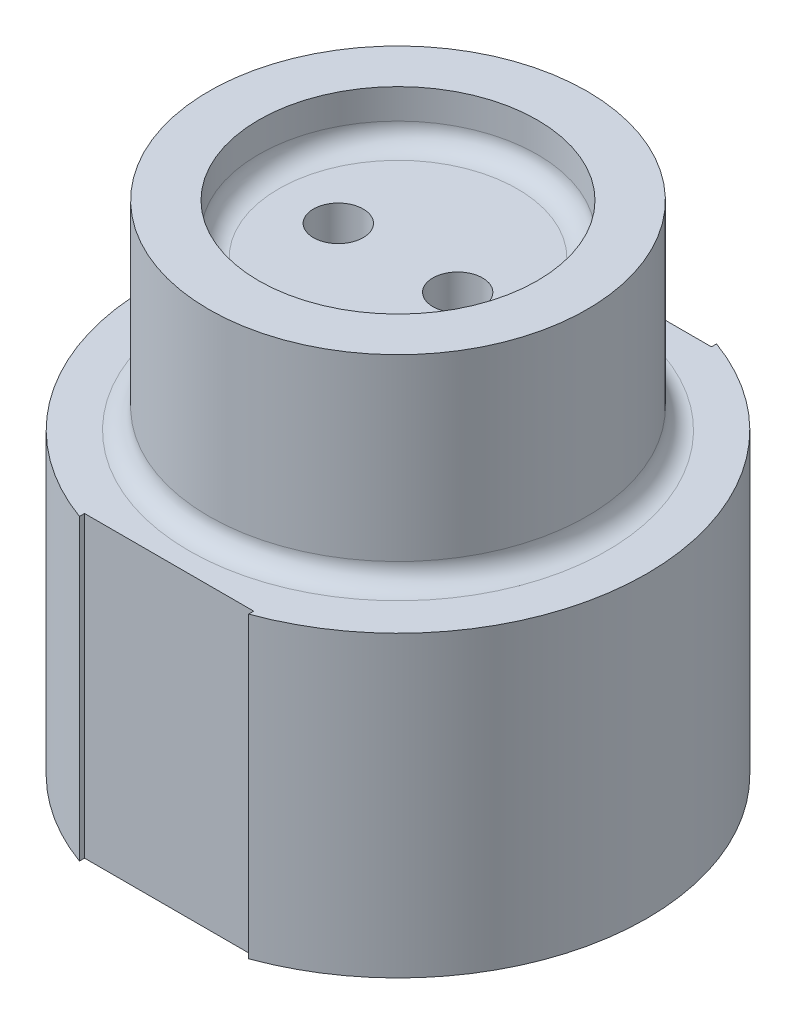
from build123d import *

# Parameters (mm, degrees)
BOSS_EXTRUDE1_START = -5.08
SKETCH2_R           = 35.56
BOSS_EXTRUDE1_DEPTH = 5.08
SKETCH3_R           = 8.89
SKETCH3_R_2         = 6.35
SKETCH5_R           = 6.35
CUT_EXTRUDE1_DEPTH  = 146.358143907
SKETCH6_R           = 6.35
CUT_EXTRUDE2_DEPTH  = 142.398403103
SKETCH7_W           = 43.18
SKETCH7_H           = 76.2
CUT_EXTRUDE3_DEPTH  = 5.08
FILLET1_R           = 5.08


with BuildPart() as part:
    # Sketch1 → Revolve1 (revolve)
    with BuildSketch(Plane.XY, mode=Mode.PRIVATE) as revolve1_sk:
        Polygon((0, 0), (63.5, 0), (63.5, 76.2), (48.26, 76.2), (48.26, 127), (35.56, 127), (35.56, 63.5), (50.8, 63.5), (50.8, 12.7), (0, 12.7), align=None)
    revolve(revolve1_sk.sketch.rotate(Axis((0, 0, 0), (0, 1, 0)), 90), axis=Axis((0, 0, 0), (0, 1, 0)))

    # Sketch2 → Boss-Extrude1 (add)
    with BuildSketch(Plane(origin=(0, 114.3, 0), x_dir=(1, 0, 0), z_dir=(0, 1, 0)).offset(BOSS_EXTRUDE1_START)):
        with Locations(Location((0, 0, 0), (0, 0, 90))):
            Circle(SKETCH2_R)
    extrude(amount=BOSS_EXTRUDE1_DEPTH)

    # Sweep1: sweep along a path in Sketch4
    with BuildLine(Plane.XY) as sweep1_path:
        Line((15.24, 114.3), (15.24, 50.8))
        Line((15.24, 50.8), (33.02, 50.8))
        Line((33.02, 50.8), (33.02, 12.7))
    # Sketch3 → Sweep1 (sweep)
    with BuildSketch(Plane(origin=(0, 114.3, 0), x_dir=(1, 0, 0), z_dir=(0, 1, 0))):
        with Locations((15.24, 0)):
            Circle(SKETCH3_R)
        with Locations((15.24, 0)):
            Circle(SKETCH3_R_2, mode=Mode.SUBTRACT)
    sweep1 = sweep(path=sweep1_path.line, transition=Transition.RIGHT)

    # Sketch5 → Cut-Extrude1 (cut, through all)
    with BuildSketch(Plane(origin=(0, 12.7, 0), x_dir=(1, 0, 0), z_dir=(0, 1, 0))):
        with Locations((33.02, 0)):
            Circle(SKETCH5_R)
    cut_extrude1 = extrude(amount=-CUT_EXTRUDE1_DEPTH, mode=Mode.SUBTRACT)

    # Sketch6 → Cut-Extrude2 (cut, through all)
    with BuildSketch(Plane.XZ.offset(-109.22)):
        with Locations(Location((15.24, 0, 0), (0, 0, 90))):
            Circle(SKETCH6_R)
    cut_extrude2 = extrude(amount=-CUT_EXTRUDE2_DEPTH, mode=Mode.SUBTRACT)

    # Mirror1: Sweep1, Cut-Extrude1, Cut-Extrude2 across plane
    add(sweep1.mirror(Plane(origin=(0, 0, 0), x_dir=(0, 0, 1), z_dir=(1, 0, 0))))
    add(cut_extrude1.mirror(Plane(origin=(0, 0, 0), x_dir=(0, 0, 1), z_dir=(1, 0, 0))), mode=Mode.SUBTRACT)
    add(cut_extrude2.mirror(Plane(origin=(0, 0, 0), x_dir=(0, 0, 1), z_dir=(1, 0, 0))), mode=Mode.SUBTRACT)

    # Sketch7 → Cut-Extrude3 (cut)
    with BuildSketch(Plane.XY.offset(63.5)):
        with Locations((0, 38.1)):
            Rectangle(SKETCH7_W, SKETCH7_H)
    cut_extrude3 = extrude(amount=-CUT_EXTRUDE3_DEPTH, mode=Mode.SUBTRACT)

    # Mirror2: Cut-Extrude3 across plane
    add(cut_extrude3.mirror(Plane.XY), mode=Mode.SUBTRACT)

    # Fillet1
    fillet1_edges = [part.edges().sort_by_distance(p)[0] for p in [
        (0, 76.2, 48.26),
        (0, 114.3, 35.56),
    ]]
    fillet(fillet1_edges, radius=FILLET1_R)


solid = part.part
